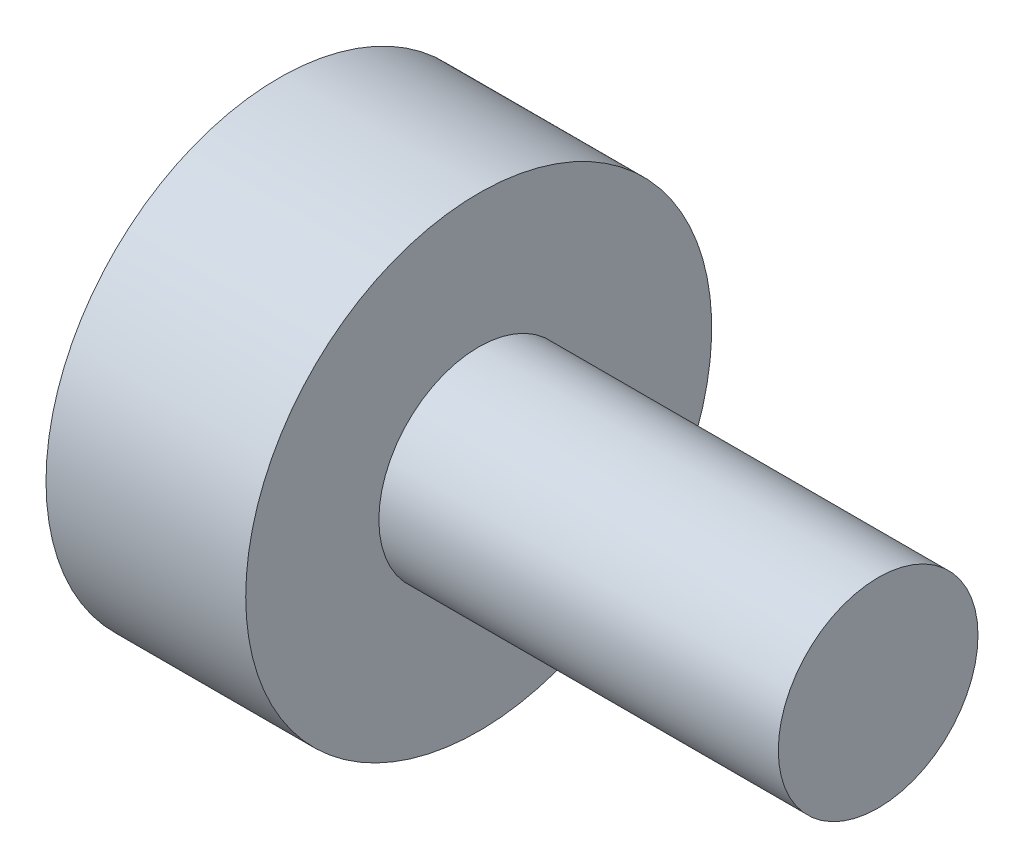
from build123d import *

# Parameters (mm, degrees)
SKETCH_2_R          = 5
CUT_EXTRUDE_1_DEPTH = 20
SKETCH_3_R          = 9
CUT_EXTRUDE_2_DEPTH = 5


with BuildPart() as part:
    # Эскиз1 → Повернуть1 (revolve)
    with BuildSketch(Plane.XY, mode=Mode.PRIVATE) as revolve_1_sk:
        Polygon((0, 0), (100, 0), (100, 15), (40, 15), (40, 35), (10, 35), (10, 20), (0, 20), align=None)
    revolve(revolve_1_sk.sketch.rotate(Axis((0, 0, 0), (1, 0, 0)), 90), axis=Axis((0, 0, 0), (1, 0, 0)))

    # Эскиз2 → Вырез-Вытянуть1 (cut)
    with BuildSketch(Plane(origin=(0, 0, 0), x_dir=(0, 0, -1), z_dir=(1, 0, 0))):
        Circle(SKETCH_2_R)
    extrude(amount=CUT_EXTRUDE_1_DEPTH, mode=Mode.SUBTRACT)

    # Эскиз3 → Вырез-Вытянуть2 (cut)
    with BuildSketch(Plane(origin=(0, 0, 0), x_dir=(0, 0, -1), z_dir=(1, 0, 0))):
        Circle(SKETCH_3_R)
    extrude(amount=CUT_EXTRUDE_2_DEPTH, mode=Mode.SUBTRACT)


solid = part.part
